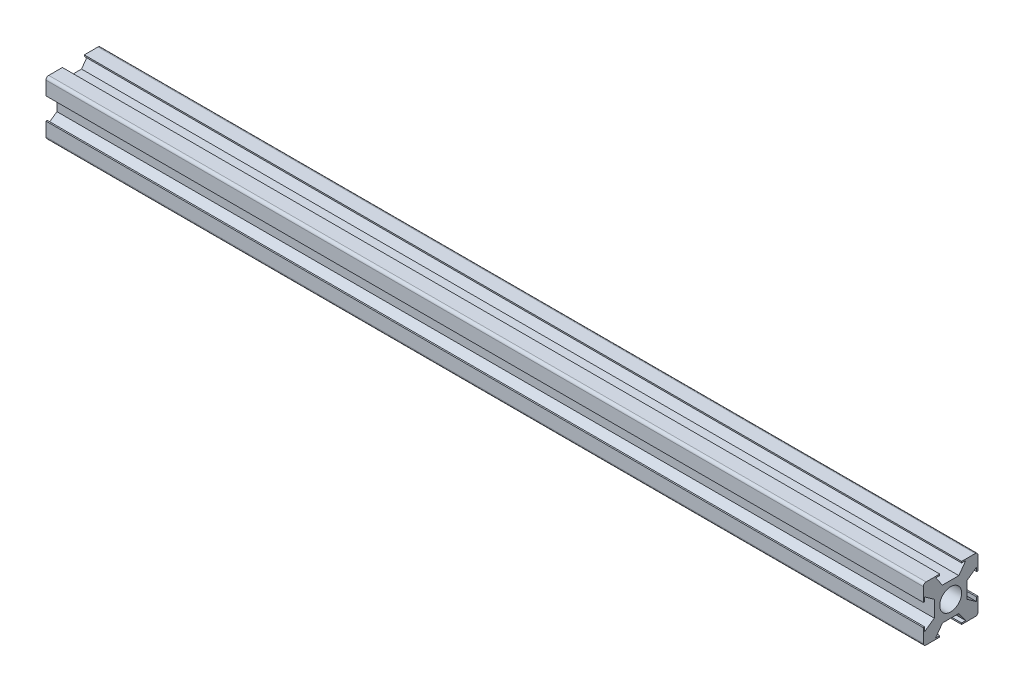
from build123d import *

# Parameters (mm, degrees)
SKETCH_1_W                       = 321
SKETCH_1_H                       = 10
EXTRUDE_1_DEPTH                  = 10
SKETCH_2_R                       = 4
CUT_EXTRUDE_1_DEPTH              = 1270
CUT_EXTRUDE_2_DEPTH              = 1270
FILLET_1_R                       = 1
PATTERN_CIRCULAR_2_COUNT         = 4
FILLET_1_OF_PATTERN_CIRCULAR_2_R = 1


with BuildPart() as part:
    # 草图1 → 凸台-拉伸1 (new body)
    with BuildSketch(Plane.XY):
        with Locations((93.981285353, -6.397869645)):
            Rectangle(SKETCH_1_W, SKETCH_1_H)
    extrude_1 = extrude(amount=EXTRUDE_1_DEPTH)

    # 草图2 → 切除-拉伸1 (cut)
    with BuildSketch(Plane(origin=(254.481285353, 0, 0), x_dir=(0, 0, -1), z_dir=(1, 0, 0))):
        with Locations((0, -11.397869645)):
            Circle(SKETCH_2_R)
    cut_extrude_1 = extrude(amount=-CUT_EXTRUDE_1_DEPTH, mode=Mode.SUBTRACT)

    # 草图3 → 切除-拉伸2 (cut)
    with BuildSketch(Plane(origin=(254.481285353, 0, 0), x_dir=(0, 0, -1), z_dir=(1, 0, 0))):
        Polygon((-4, -1.397869645), (0, -1.397869645), (0, -5.397869645), (-3, -5.397869645), (-5.5, -1.897869645), (-4, -1.897869645), align=None)
        Polygon((-10, -7.397869645), (-10, -11.397869645), (-6, -11.397869645), (-6, -8.397869645), (-9.5, -5.897869645), (-9.5, -7.397869645), align=None)
    cut_extrude_2 = extrude(amount=-CUT_EXTRUDE_2_DEPTH, mode=Mode.SUBTRACT)

    # 圆角1
    fillet_1_edges = [part.edges().sort_by_distance(p)[0] for p in [
        (93.981285353, -1.397869645, 10),
    ]]
    fillet(fillet_1_edges, radius=FILLET_1_R)

    # 阵列(圆周)2: 凸台-拉伸1, 切除-拉伸1, 切除-拉伸2 ×4 about axis
    pattern_circular_2_axis = Axis((0, -11.397869645, 0), (1, 0, 0))
    add([extrude_1.rotate(pattern_circular_2_axis, i * 360 / PATTERN_CIRCULAR_2_COUNT) for i in range(1, PATTERN_CIRCULAR_2_COUNT)])
    add([cut_extrude_1.rotate(pattern_circular_2_axis, i * 360 / PATTERN_CIRCULAR_2_COUNT) for i in range(1, PATTERN_CIRCULAR_2_COUNT)], mode=Mode.SUBTRACT)
    add([cut_extrude_2.rotate(pattern_circular_2_axis, i * 360 / PATTERN_CIRCULAR_2_COUNT) for i in range(1, PATTERN_CIRCULAR_2_COUNT)], mode=Mode.SUBTRACT)

    # 圆角1 of 阵列(圆周)2
    fillet_1_of_pattern_circular_2_edges = [part.edges().sort_by_distance(p)[0] for p in [
        (93.981285353, -21.397869645, 10),
        (93.981285353, -21.397869645, -10),
        (93.981285353, -1.397869645, -10),
    ]]
    fillet(fillet_1_of_pattern_circular_2_edges, radius=FILLET_1_OF_PATTERN_CIRCULAR_2_R)


solid = part.part
